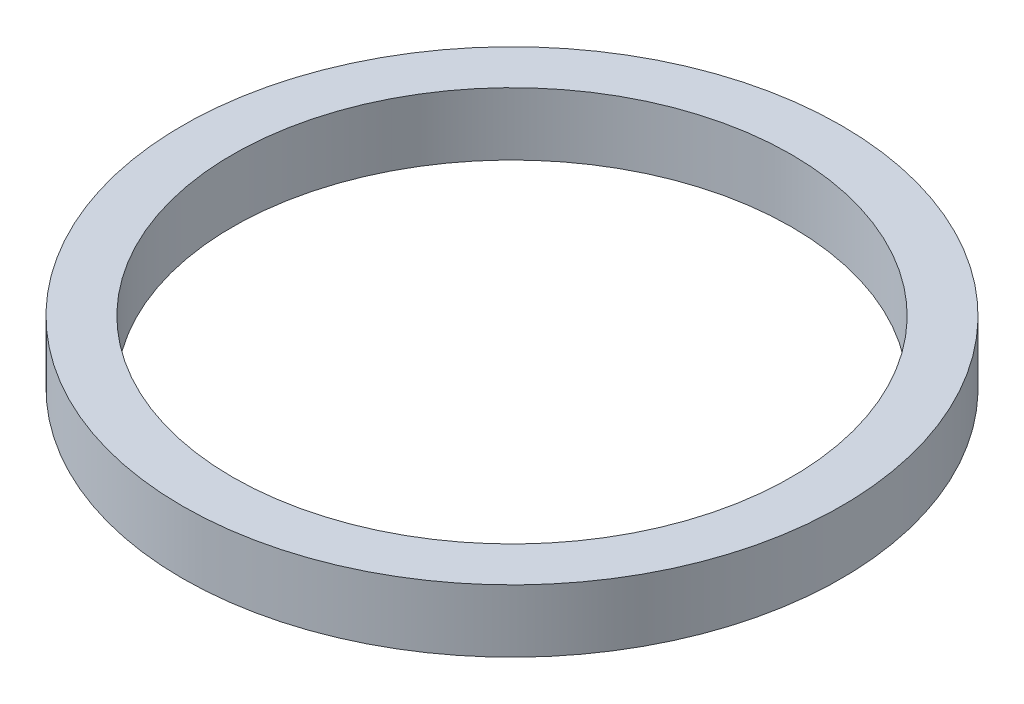
from build123d import *

# Parameters (mm, degrees)
SKETCH1_W = 2.54
SKETCH1_H = 3.175


with BuildPart() as part:
    # Sketch1 → Revolve1 (revolve)
    with BuildSketch(Plane.XY, mode=Mode.PRIVATE) as revolve1_sk:
        with Locations((-15.4305, 0)):
            Rectangle(SKETCH1_W, SKETCH1_H)
    revolve(revolve1_sk.sketch.rotate(Axis((0, 0, 0), (0, 1, 0)), 270), axis=Axis((0, 0, 0), (0, 1, 0)))


solid = part.part
